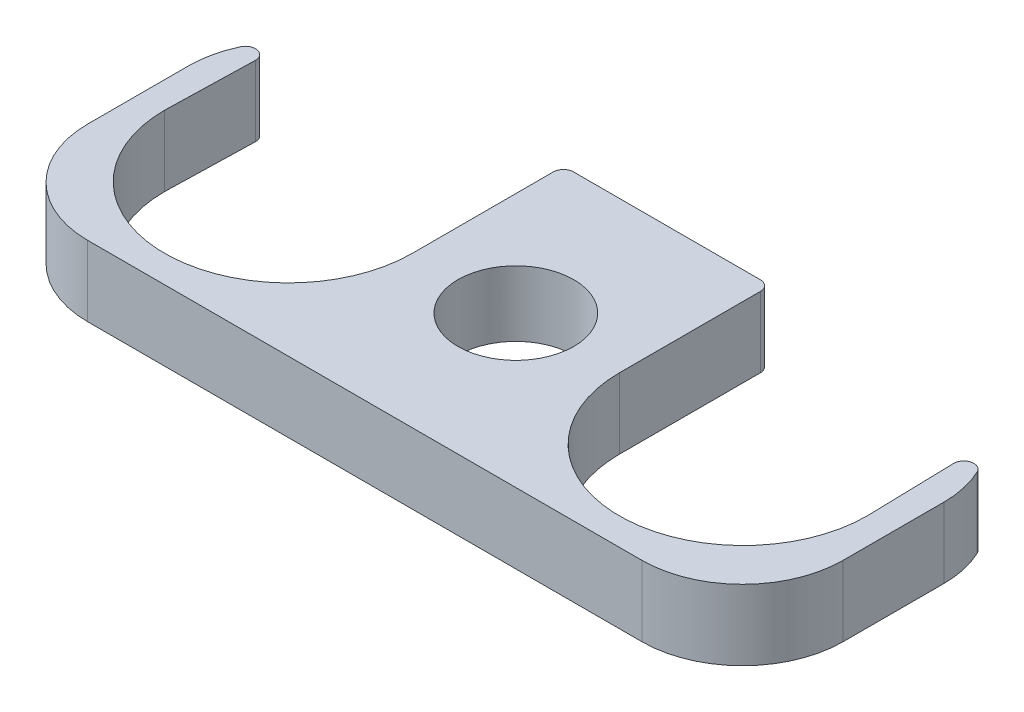
from build123d import *

# Parameters (mm, degrees)
SKETCH1_R           = 5.75
BOSS_EXTRUDE1_DEPTH = 7
CUT_EXTRUDE1_DEPTH  = 7
FILLET1_R           = 1
FILLET2_R           = 1
FILLET3_R           = 1
FILLET4_R           = 1
CUT_EXTRUDE2_DEPTH  = 0.5


with BuildPart() as part:
    # Sketch1 → Boss-Extrude1 (new body)
    with BuildSketch(Plane(origin=(0, 0, 0), x_dir=(1, 0, 0), z_dir=(0, 1, 0))):
        with BuildLine():
            Line((-27.5, -15), (27.5, -15))
            ThreePointArc((27.5, -15), (34.571067812, -12.071067812), (37.5, -5))
            Line((37.5, -5), (37.5, 5))
            ThreePointArc((37.5, 5), (34.571067812, 12.071067812), (27.5, 15))
            Line((27.5, 15), (-27.5, 15))
            ThreePointArc((-27.5, 15), (-34.571067812, 12.071067812), (-37.5, 5))
            Line((-37.5, 5), (-37.5, -5))
            ThreePointArc((-37.5, -5), (-34.571067812, -12.071067812), (-27.5, -15))
        make_face()
        Circle(SKETCH1_R, mode=Mode.SUBTRACT)
    extrude(amount=BOSS_EXTRUDE1_DEPTH)

    # Sketch2 → Cut-Extrude1 (cut)
    with BuildSketch(Plane(origin=(0, 7, 0), x_dir=(1, 0, 0), z_dir=(0, 1, 0))):
        with BuildLine():
            Line((-34.875660829, 0), (-34.571067812, 12.071067812))
            Line((-34.571067812, 12.071067812), (-34.571067812, 15))
            Line((-34.571067812, 15), (-27.5, 15))
            Line((-27.5, 15), (-10.275660829, 15))
            Line((-10.275660829, 15), (-10.275660829, 0))
            ThreePointArc((-10.275660829, 0), (-22.575660829, -12.3), (-34.875660829, 0))
        make_face()
    cut_extrude1 = extrude(amount=-CUT_EXTRUDE1_DEPTH, mode=Mode.SUBTRACT)

    # Fillet1
    fillet1_edges = [part.edges().sort_by_distance(p)[0] for p in [
        (-34.571067812, 3.5, -12.071067812),
    ]]
    fillet(fillet1_edges, radius=FILLET1_R)

    # Fillet2
    fillet2_edges = [part.edges().sort_by_distance(p)[0] for p in [
        (-10.275660829, 3.5, -15),
    ]]
    fillet(fillet2_edges, radius=FILLET2_R)

    # Mirror1: Cut-Extrude1 across plane
    add(cut_extrude1.mirror(Plane.ZY), mode=Mode.SUBTRACT)

    # Fillet3
    fillet3_edges = [part.edges().sort_by_distance(p)[0] for p in [
        (10.275660829, 3.5, -15),
    ]]
    fillet(fillet3_edges, radius=FILLET3_R)

    # Fillet4
    fillet4_edges = [part.edges().sort_by_distance(p)[0] for p in [
        (34.571067812, 3.5, -12.071067812),
    ]]
    fillet(fillet4_edges, radius=FILLET4_R)

    # Sketch3 → Cut-Extrude2 (cut)
    with BuildSketch(Plane.XZ):
        Polygon((0, 10.201614586), (-8.834857391, 5.100807293), (-8.834857391, -5.100807293), (0, -10.201614586), (8.834857391, -5.100807293), (8.834857391, 5.100807293), align=None)
    extrude(amount=-CUT_EXTRUDE2_DEPTH, mode=Mode.SUBTRACT)


solid = part.part
